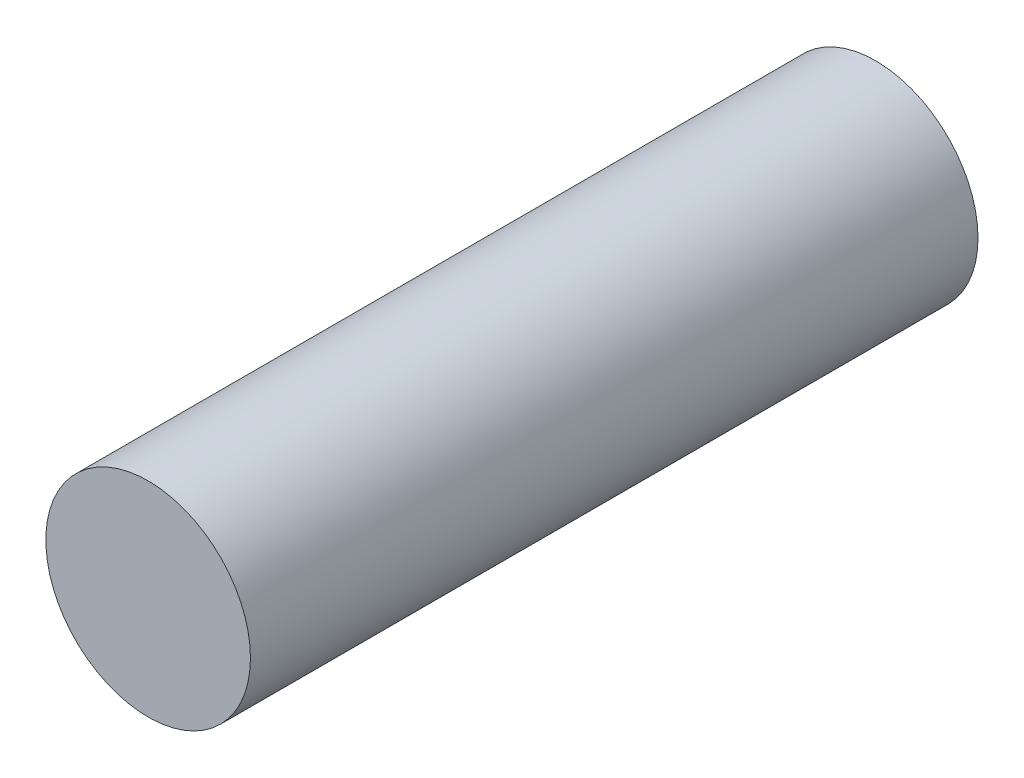
from build123d import *

# Parameters (mm, degrees)
SKETCH_1_R      = 4.5
EXTRUDE_1_DEPTH = 32


with BuildPart() as part:
    # 草图1 → 凸台-拉伸1 (new body)
    with BuildSketch(Plane.XY):
        Circle(SKETCH_1_R)
    extrude(amount=-EXTRUDE_1_DEPTH)


solid = part.part
